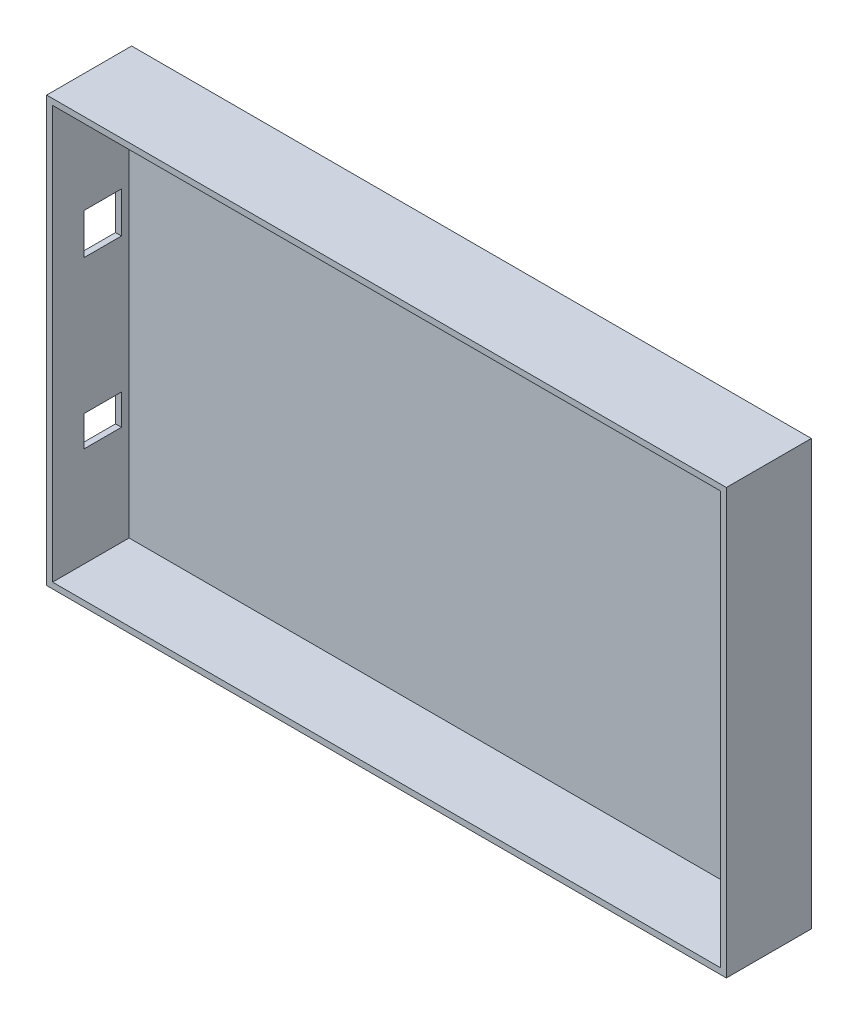
from build123d import *

# Parameters (mm, degrees)
SKETCH1_W           = 203.2
SKETCH1_H           = 127
BOSS_EXTRUDE1_DEPTH = 25.4
SKETCH2_W           = 199.644
SKETCH2_H           = 123.444
CUT_EXTRUDE1_DEPTH  = 22.86
SKETCH4_W           = 11.176
SKETCH4_H           = 12.192
SKETCH4_H_2         = 9.144
CUT_EXTRUDE2_DEPTH  = 1.778


with BuildPart() as part:
    # Sketch1 → Boss-Extrude1 (new body)
    with BuildSketch(Plane.XY):
        with Locations((101.6, 63.5)):
            Rectangle(SKETCH1_W, SKETCH1_H)
    extrude(amount=BOSS_EXTRUDE1_DEPTH)

    # Sketch2 → Cut-Extrude1 (cut)
    with BuildSketch(Plane.XY.offset(25.4)):
        with Locations((101.6, 63.5)):
            Rectangle(SKETCH2_W, SKETCH2_H)
    extrude(amount=-CUT_EXTRUDE1_DEPTH, mode=Mode.SUBTRACT)

    # Sketch4 → Cut-Extrude2 (cut)
    with BuildSketch(Plane.ZY):
        with Locations((10.414, 87.206902012)):
            Rectangle(SKETCH4_W, SKETCH4_H)
        with Locations((10.414, 36.152902012)):
            Rectangle(SKETCH4_W, SKETCH4_H_2)
    extrude(amount=-CUT_EXTRUDE2_DEPTH, mode=Mode.SUBTRACT)


solid = part.part
